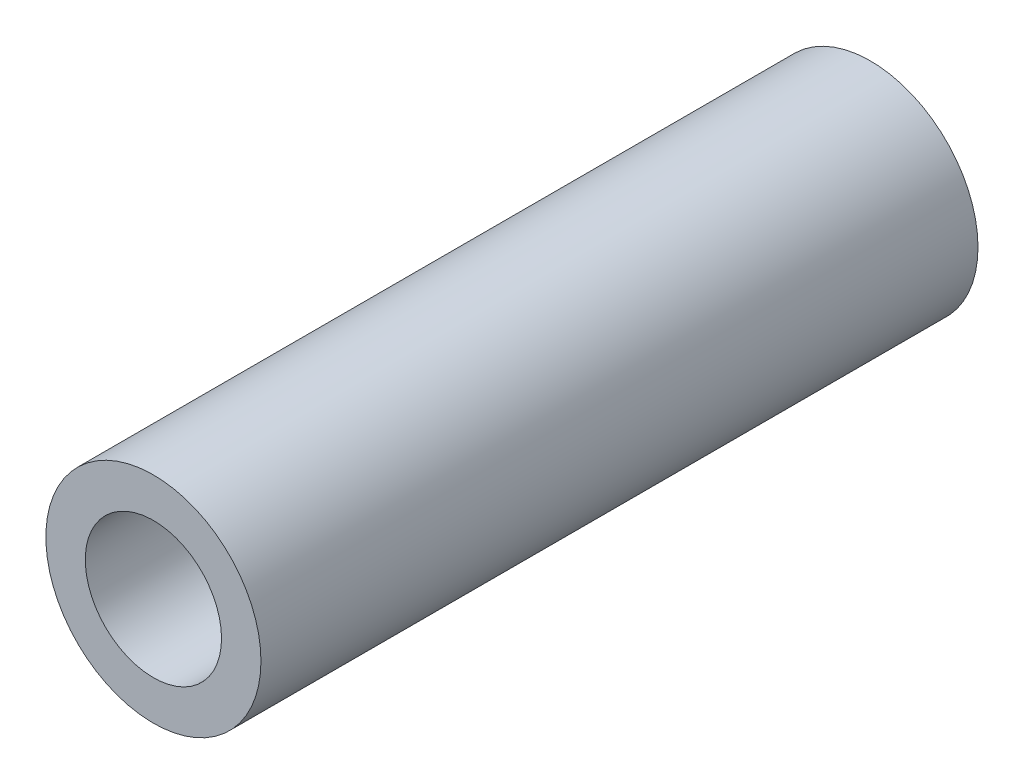
from build123d import *

# Parameters (mm, degrees)
SKETCH2_R           = 7.62
SKETCH2_R_2         = 4.826
BOSS_EXTRUDE1_DEPTH = 50.8


with BuildPart() as part:
    # Sketch2 → Boss-Extrude1 (new body)
    with BuildSketch(Plane.XY):
        Circle(SKETCH2_R)
        Circle(SKETCH2_R_2, mode=Mode.SUBTRACT)
    extrude(amount=BOSS_EXTRUDE1_DEPTH)


solid = part.part
